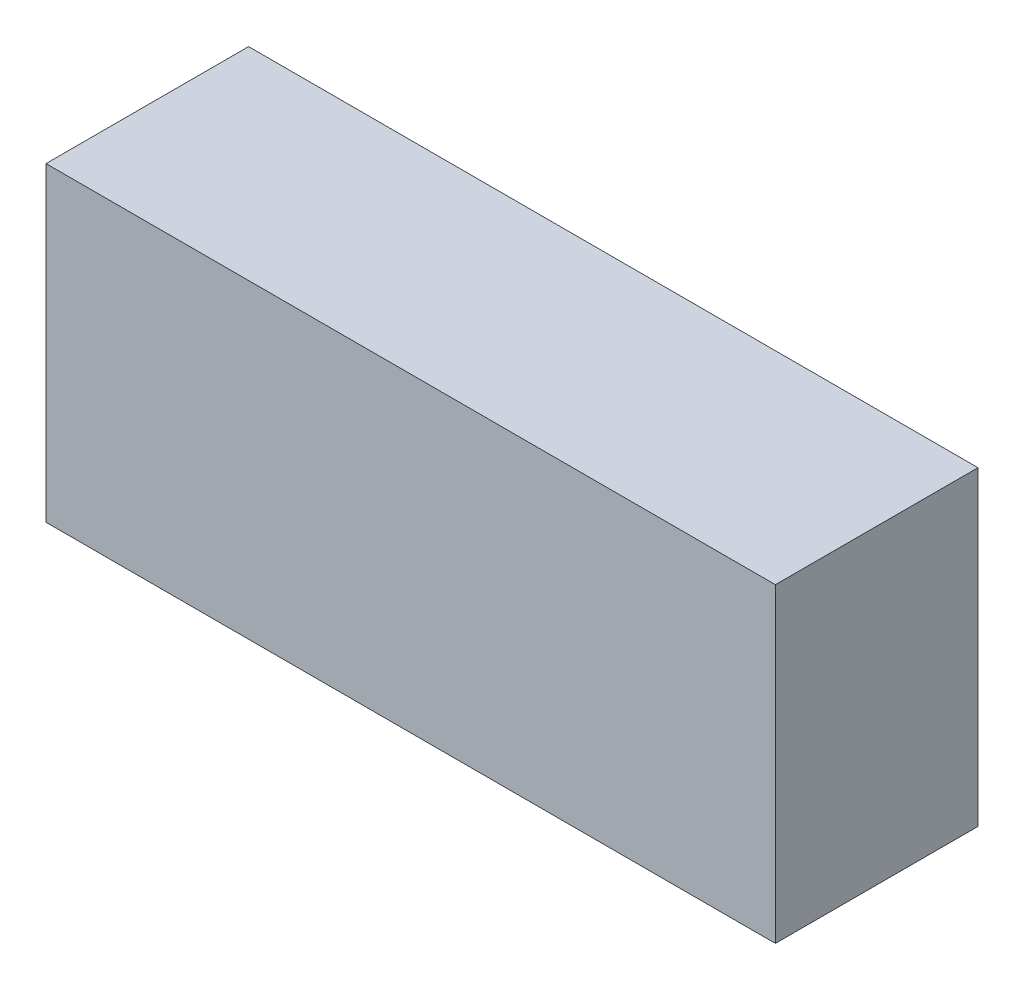
from build123d import *

# Parameters (mm, degrees)
SKETCH_1_W      = 54
SKETCH_1_H      = 23
EXTRUDE_1_DEPTH = 15


with BuildPart() as part:
    # 草图1 → 凸台-拉伸1 (new body)
    with BuildSketch(Plane.XY):
        with Locations((27, 11.5)):
            Rectangle(SKETCH_1_W, SKETCH_1_H)
    extrude(amount=EXTRUDE_1_DEPTH)


solid = part.part
